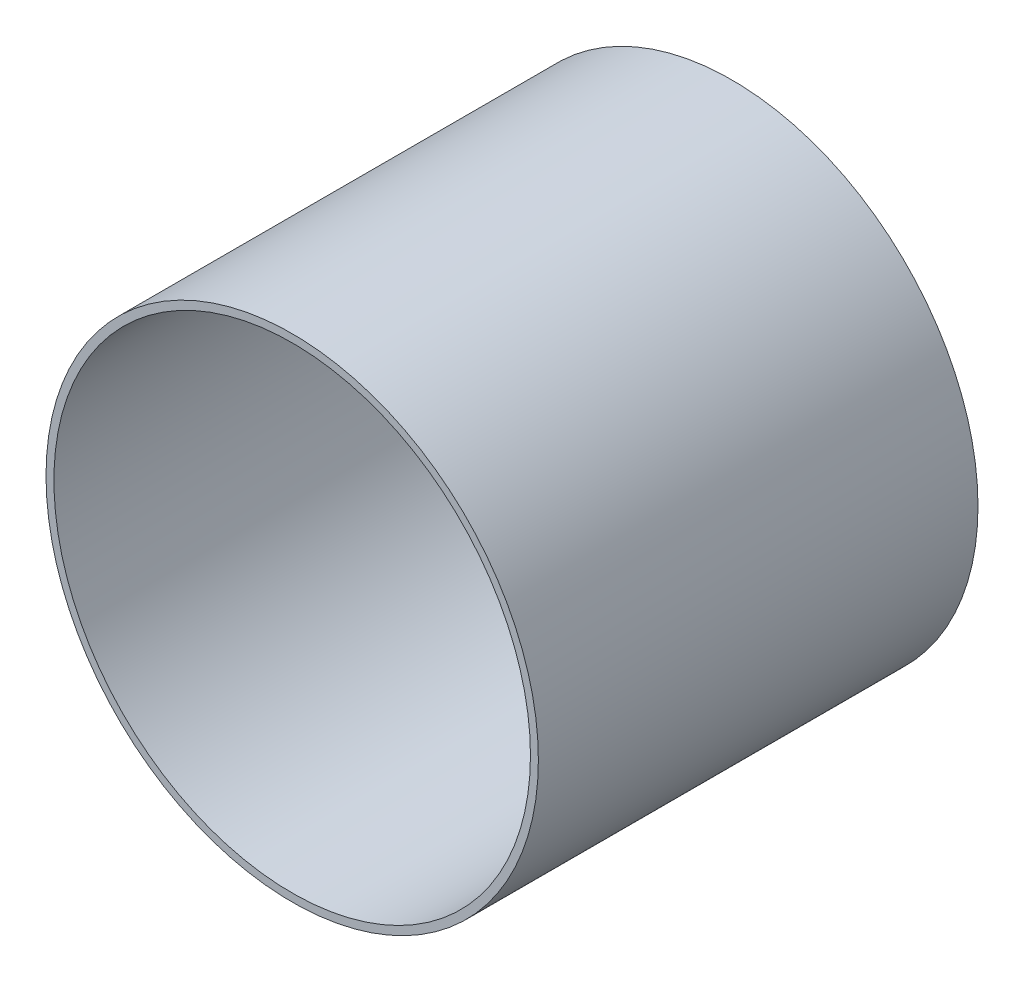
from build123d import *

# Parameters (mm, degrees)
SKETCH1_R           = 14
SKETCH1_R_2         = 13.55
BOSS_EXTRUDE1_DEPTH = 25


with BuildPart() as part:
    # Sketch1 → Boss-Extrude1 (new body)
    with BuildSketch(Plane.XY):
        Circle(SKETCH1_R)
        Circle(SKETCH1_R_2, mode=Mode.SUBTRACT)
    extrude(amount=BOSS_EXTRUDE1_DEPTH)


solid = part.part
